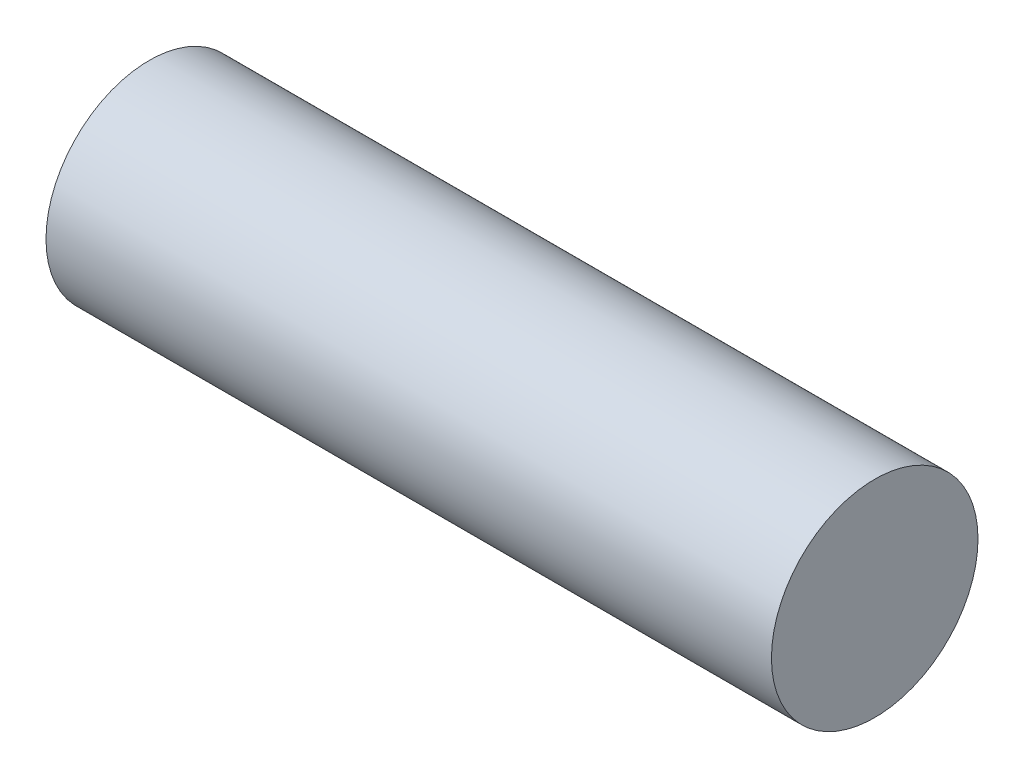
from build123d import *

# Parameters (mm, degrees)
SKETCH1_R           = 10.25
BOSS_EXTRUDE1_DEPTH = 72


with BuildPart() as part:
    # Sketch1 → Boss-Extrude1 (new body)
    with BuildSketch(Plane(origin=(0, 0, 0), x_dir=(0, 0, -1), z_dir=(1, 0, 0))):
        Circle(SKETCH1_R)
    extrude(amount=BOSS_EXTRUDE1_DEPTH)


solid = part.part
